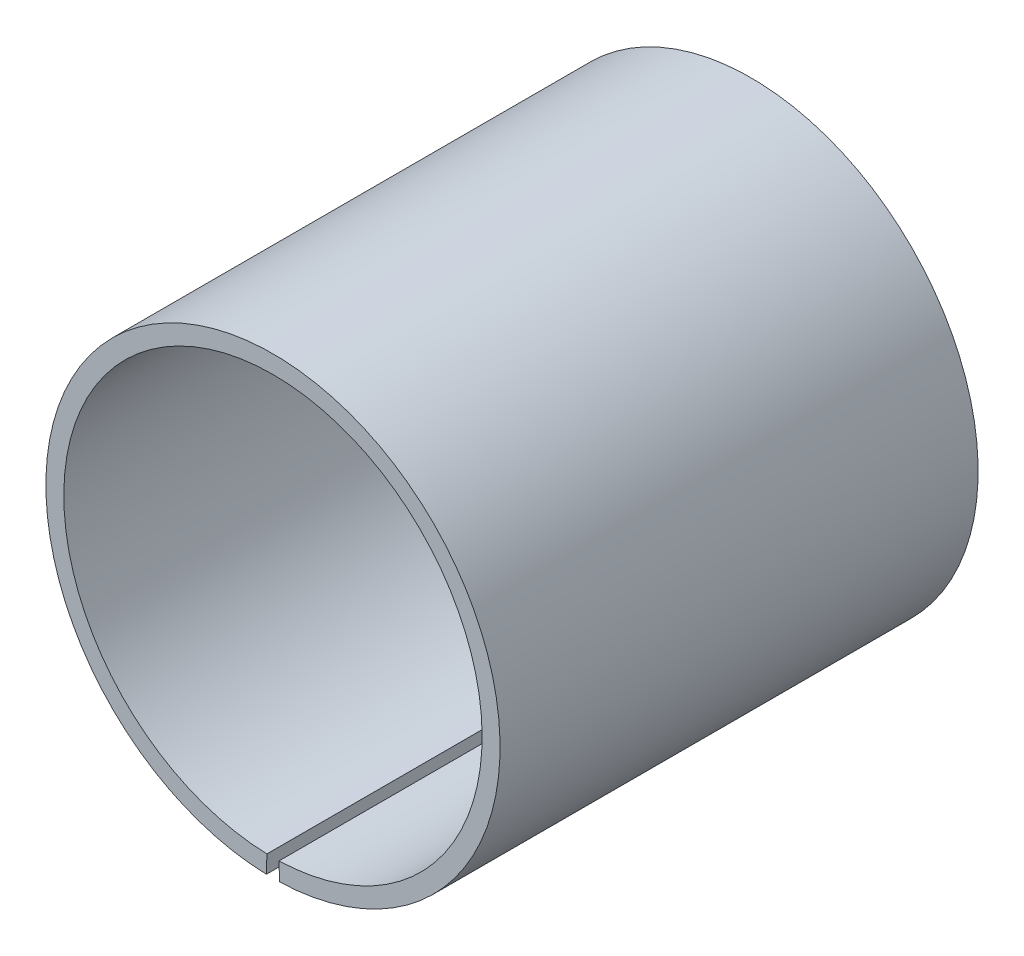
from build123d import *

# Parameters (mm, degrees)
BOSS_EXTRUDE1_DEPTH = 40


with BuildPart() as part:
    # Sketch1 → Boss-Extrude1 (new body)
    with BuildSketch(Plane.XY):
        with BuildLine():
            Line((-0.506756832, -17.492661247), (-0.550193132, -18.992032211))
            ThreePointArc((-0.550193132, -18.992032211), (0, 19), (0.550193132, -18.992032211))
            Line((0.550193132, -18.992032211), (0.506756832, -17.492661247))
            ThreePointArc((0.506756832, -17.492661247), (0, 17.5), (-0.506756832, -17.492661247))
        make_face()
    extrude(amount=BOSS_EXTRUDE1_DEPTH)


solid = part.part
